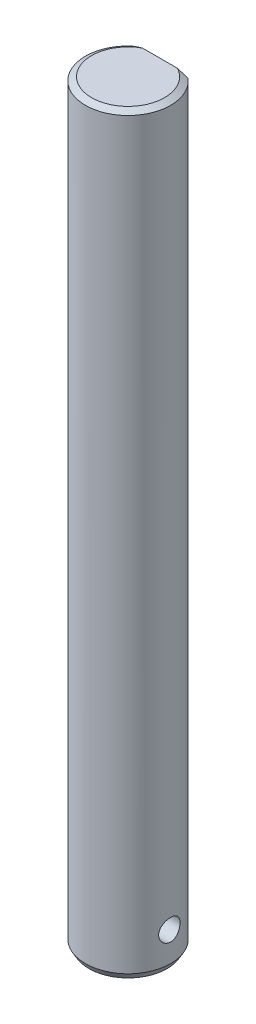
from build123d import *
from OCP.BRepFilletAPI import BRepFilletAPI_MakeChamfer

# Parameters (mm, degrees)
SKETCH1_R           = 6
BOSS_EXTRUDE1_DEPTH = 106
SKETCH2_W           = 12.467437383
SKETCH2_H           = 3.782068253
CUT_EXTRUDE1_DEPTH  = 10
SKETCH3_R           = 1.5
CUT_EXTRUDE2_DEPTH  = 50
CHAMFER1_SIZE       = 0.5
CHAMFER1_SIZE2      = 0.866025404


with BuildPart() as part:
    # Sketch1 → Boss-Extrude1 (new body)
    with BuildSketch(Plane(origin=(0, 0, 0), x_dir=(1, 0, 0), z_dir=(0, 1, 0))):
        with Locations(Location((0, 0, 0), (0, 0, 270))):
            Circle(SKETCH1_R)
    extrude(amount=BOSS_EXTRUDE1_DEPTH)

    # Sketch2 → Cut-Extrude1 (cut)
    with BuildSketch(Plane(origin=(0, 106, 0), x_dir=(1, 0, 0), z_dir=(0, 1, 0))):
        with Locations((0.125511115, 6.391034127)):
            Rectangle(SKETCH2_W, SKETCH2_H)
    extrude(amount=-CUT_EXTRUDE1_DEPTH, mode=Mode.SUBTRACT)

    # Sketch3 → Cut-Extrude2 (cut, symmetric)
    with BuildSketch(Plane(origin=(0, 0, 0), x_dir=(0, 0, -1), z_dir=(1, 0, 0))):
        with Locations((0, 5)):
            Circle(SKETCH3_R)
    extrude(amount=CUT_EXTRUDE2_DEPTH, both=True, mode=Mode.SUBTRACT)

    # Chamfer1: one chamfer whose edges measure the first distance from different faces: ONE call of the kernel's chamfer builder (chamfer() names one face for all edges)
    chamfer1_edges_1 = [part.edges().sort_by_distance(p)[0] for p in [
        (0, 0, -6),
    ]]
    chamfer1_side_1 = [part.faces().sort_by_distance(p)[0] for p in [
        (0, 0, 0),
    ]]
    chamfer1_edges_2 = [part.edges().sort_by_distance(p)[0] for p in [
        (5.61248608, 106, 2.121320344),
    ]]
    chamfer1_side_2 = [part.faces().sort_by_distance(p)[0] for p in [
        (0, 53, -6),
    ]]
    chamfer1 = BRepFilletAPI_MakeChamfer(part.part.solid().wrapped)
    for e in chamfer1_edges_1:
        chamfer1.Add(CHAMFER1_SIZE, CHAMFER1_SIZE2, e.wrapped, chamfer1_side_1[0].wrapped)  # the first distance lies on this face
    for e in chamfer1_edges_2:
        chamfer1.Add(CHAMFER1_SIZE, CHAMFER1_SIZE2, e.wrapped, chamfer1_side_2[0].wrapped)  # the first distance lies on this face
    add(Compound.cast(chamfer1.Shape()), mode=Mode.REPLACE)


solid = part.part
